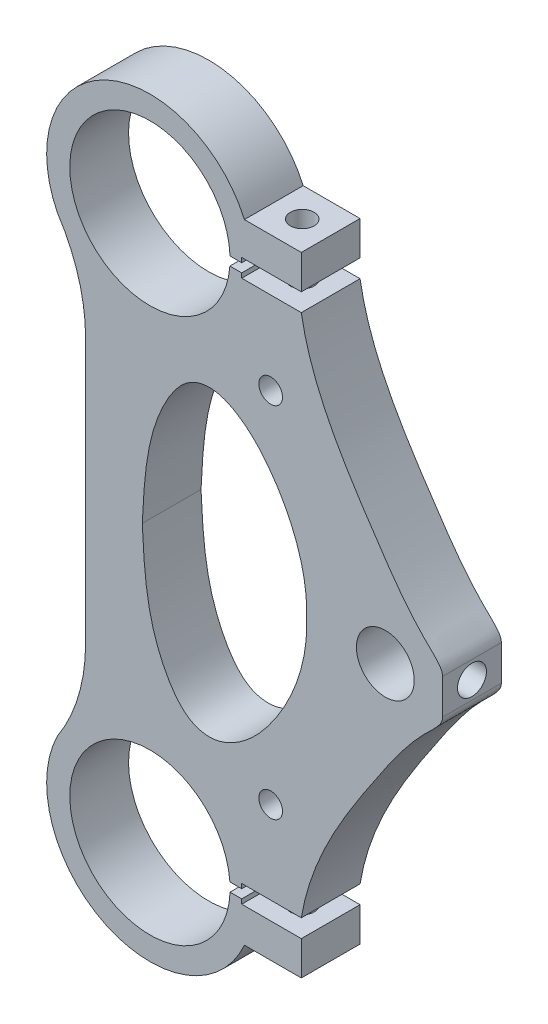
from build123d import *

# Parameters (mm, degrees)
SCHIZZO1_R                     = 2.5
ESTRUSIONE_ESTRUSIONE1_DEPTH   = 5.08
FORO_FILETTATO_M2_5X0_45_1_D   = 2.05
FORO_FILETTATO_M3X0_5_1_REACH  = 80.829
FORO_FILETTATO_M3X0_5_1_BORE_R = 1.25


with BuildPart() as part:
    # Schizzo1 → Estrusione-Estrusione1 (new body)
    with BuildSketch(Plane.XY):
        with BuildLine():
            Line((10.78299118, 49.780959651), (10.78299118, 26.898787325))
            ThreePointArc((10.78299118, 26.898787325), (10.339487436, 23.297689716), (9.035482204, 19.911811705))
            ThreePointArc((9.035482204, 19.911811705), (8.70291473, 19.32141597), (8.343745321, 18.7468156))
            ThreePointArc((8.343745321, 18.7468156), (12.559578595, 6.695692747), (24.514917355, 11.175948023))
            Line((24.514917355, 11.175948023), (29.432282014, 11.175948023))
            Line((29.432282014, 11.175948023), (29.432282014, 14.125948023))
            Line((29.432282014, 14.125948023), (24.282282014, 14.125948023))
            Line((24.282282014, 14.125948023), (24.282282014, 14.525948023))
            Line((24.282282014, 14.525948023), (23.271153051, 14.525948023))
            ThreePointArc((23.271153051, 14.525948023), (9.416981792, 14.662564542), (23.257993682, 15.281527553))
            Line((23.257993682, 15.281527553), (24.282282014, 15.281527553))
            Line((24.282282014, 15.281527553), (24.282282014, 15.681527553))
            Line((24.282282014, 15.681527553), (29.432282014, 15.681527553))
            add(Edge.make_bspline(
                [(29.432282014, 15.681527553), (30.28849394, 20.768740112), (33.989676552, 26.542735909), (38.12926078, 32.628075923), (40.026271169, 34.752771823), (41.110826736, 35.725265219), (41.648042989, 36.454929263), (41.648042989, 36.817827012)],
                knots=[0, 0, 0, 0, 0.614811257, 0.820091791, 0.896456597, 0.958730004, 1, 1, 1, 1], degree=3))
            Line((41.648042989, 36.817827012), (41.648042989, 39.861919964))
            add(Edge.make_bspline(
                [(29.432282014, 60.998219422), (30.28849394, 55.911006863), (33.989676552, 50.137011066), (38.12926078, 44.051671053), (40.026271169, 41.926975153), (41.110826736, 40.954481756), (41.648042989, 40.224817712), (41.648042989, 39.861919964)],
                knots=[0, 0, 0, 0, 0.614811257, 0.820091791, 0.896456597, 0.958730004, 1, 1, 1, 1], degree=3))
            Line((29.432282014, 60.998219422), (24.282282014, 60.998219422))
            Line((24.282282014, 60.998219422), (24.282282014, 61.398219422))
            Line((24.282282014, 61.398219422), (23.257993682, 61.398219422))
            ThreePointArc((23.257993682, 61.398219422), (9.416981792, 62.017182434), (23.271153051, 62.153798952))
            Line((23.271153051, 62.153798952), (24.282282014, 62.153798952))
            Line((24.282282014, 62.153798952), (24.282282014, 62.553798952))
            Line((24.282282014, 62.553798952), (29.432282014, 62.553798952))
            Line((29.432282014, 62.553798952), (29.432282014, 65.503798952))
            Line((29.432282014, 65.503798952), (24.514917355, 65.503798952))
            ThreePointArc((24.514917355, 65.503798952), (12.559578595, 69.984054228), (8.343745321, 57.932931375))
            ThreePointArc((8.343745321, 57.932931375), (8.70291473, 57.358331006), (9.035482204, 56.767935271))
            ThreePointArc((9.035482204, 56.767935271), (10.339487436, 53.382057259), (10.78299118, 49.780959651))
        make_face()
        with BuildLine():
            add(Edge.make_bspline(
                [(15.682597142, 38.339873488), (15.862127321, 34.83902794), (16.076956788, 30.195397892), (19.436029343, 25.500544959), (22.003237557, 25.120656017), (24.462992199, 26.161428979), (27.017677892, 28.909232559), (29.309944893, 33.118967607), (29.972256674, 36.502062861), (29.886078718, 38.339873488)],
                knots=[0, 0, 0, 0, 0.321954935, 0.444159149, 0.483908226, 0.555795087, 0.68318302, 0.828712277, 1, 1, 1, 1], degree=3))
            add(Edge.make_bspline(
                [(15.682597142, 38.339873488), (15.862127321, 41.840719035), (16.076956788, 46.484349083), (19.436029343, 51.179202017), (22.003237557, 51.559090959), (24.462992199, 50.518317996), (27.017677892, 47.770514416), (29.309944893, 43.560779368), (29.972256674, 40.177684115), (29.886078718, 38.339873488)],
                knots=[0, 0, 0, 0, 0.321954935, 0.444159149, 0.483908226, 0.555795087, 0.68318302, 0.828712277, 1, 1, 1, 1], degree=3))
        make_face(mode=Mode.SUBTRACT)
        with Locations((36.696640264, 38.339873488)):
            Circle(SCHIZZO1_R, mode=Mode.SUBTRACT)
    extrude(amount=ESTRUSIONE_ESTRUSIONE1_DEPTH)

    # Foro filettato M2.5x0.45-1 (through all)
    with Locations(Plane.XY.offset(5.08)):
        with Locations((26.78299118, 22.839873488), (26.78299118, 53.839873488)):
            Hole(FORO_FILETTATO_M2_5X0_45_1_D / 2)

    # Foro filettato M3x0.5-1 bore → Foro filettato M3x0.5-1 (cut, up to next)
    with BuildSketch(Plane(origin=(41.648042989, 0, 0), x_dir=(0, 0, -1), z_dir=(1, 0, 0)), mode=Mode.PRIVATE) as foro_filettato_m3x0_5_1_sk1:
        with Locations((-2.54, 38.339873488)):
            Circle(FORO_FILETTATO_M3X0_5_1_BORE_R)
    foro_filettato_m3x0_5_1_tool1 = extrude(foro_filettato_m3x0_5_1_sk1.sketch, amount=-FORO_FILETTATO_M3X0_5_1_REACH, mode=Mode.PRIVATE) & part.part
    add(foro_filettato_m3x0_5_1_tool1.solids().sort_by_distance((41.648043, 38.339873, 2.54))[0], mode=Mode.SUBTRACT)

    # Schizzo7 → Foro filettato M2.5x0.45-2 (revolve, cut)
    with BuildSketch(Plane(origin=(26.973599685, 65.503798952, 2.54), x_dir=(0, 0, 1), z_dir=(1, 0, 0))):
        Polygon((0, 0), (0, 10.615882135), (1.025, 10), (1.025, 0), align=None)
    foro_filettato_m2_5x0_45_2 = revolve(axis=Axis((26.973599685, 71.853798952, 2.54), (0, -1, 0)), mode=Mode.SUBTRACT)

    # Specchia1: Foro filettato M2.5x0.45-2 across plane
    add(foro_filettato_m2_5x0_45_2.mirror(Plane.ZX.offset(38.339873488)), mode=Mode.SUBTRACT)


solid = part.part
